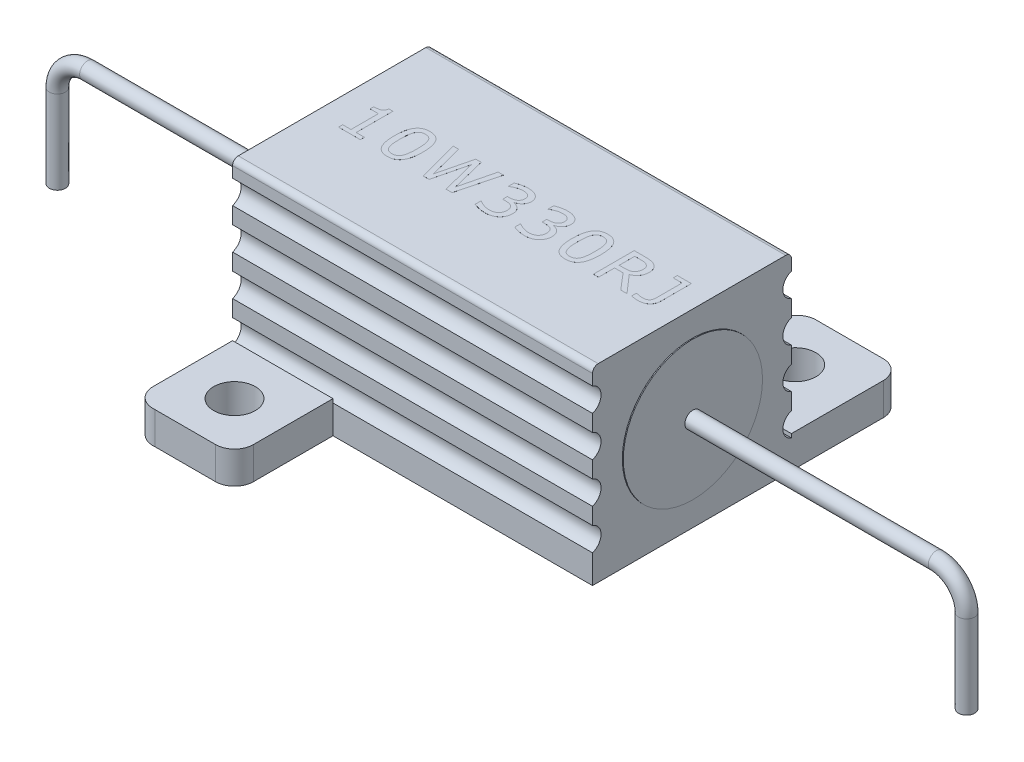
from build123d import *

# Parameters (mm, degrees)
BOSS_EXTRUDE1_DEPTH = 9.5
SKETCH2_R           = 1.1
BOSS_EXTRUDE2_DEPTH = 1.7
SKETCH3_R           = 3.675
BOSS_EXTRUDE3_DEPTH = 9.55
BOSS_EXTRUDE6_DEPTH = 0.001
SWEEP1_PROFILE_R    = 0.425


with BuildPart() as part:
    # Sketch1 → Boss-Extrude1 (new, symmetric)
    with BuildSketch(Plane(origin=(0, 0, 0), x_dir=(0, 0, -1), z_dir=(1, 0, 0))):
        with BuildLine():
            Line((-4.95, 5), (4.95, 5))
            ThreePointArc((4.95, 5), (5.162132034, 4.912132034), (5.25, 4.7))
            Line((5.25, 4.7), (5.25, 4.125))
            ThreePointArc((5.25, 4.125), (4.8, 3.5), (5.25, 2.875))
            Line((5.25, 2.875), (5.25, 2))
            ThreePointArc((5.25, 2), (4.8, 1.375), (5.25, 0.75))
            Line((5.25, 0.75), (5.25, -0.125))
            ThreePointArc((5.25, -0.125), (4.8, -0.75), (5.25, -1.375))
            Line((5.25, -1.375), (5.25, -2.25))
            ThreePointArc((5.25, -2.25), (4.8, -2.875), (5.25, -3.5))
            Line((5.25, -3.5), (5.25, -5))
            Line((5.25, -5), (-5.25, -5))
            Line((-5.25, -5), (-5.25, -3.5))
            ThreePointArc((-5.25, -3.5), (-4.8, -2.875), (-5.25, -2.25))
            Line((-5.25, -2.25), (-5.25, -1.375))
            ThreePointArc((-5.25, -1.375), (-4.8, -0.75), (-5.25, -0.125))
            Line((-5.25, -0.125), (-5.25, 0.75))
            ThreePointArc((-5.25, 0.75), (-4.8, 1.375), (-5.25, 2))
            Line((-5.25, 2), (-5.25, 2.875))
            ThreePointArc((-5.25, 2.875), (-4.8, 3.5), (-5.25, 4.125))
            Line((-5.25, 4.125), (-5.25, 4.7))
            ThreePointArc((-5.25, 4.7), (-5.162132034, 4.912132034), (-4.95, 5))
        make_face()
    extrude(amount=BOSS_EXTRUDE1_DEPTH, both=True)

    # Sketch2 → Boss-Extrude2 (add)
    # profile 1 of 2: a face of its own
    with BuildSketch(Plane.XZ.offset(5)):
        with BuildLine():
            Line((-4.2, 9.45), (-4.2, 5.25))
            Line((-4.2, 5.25), (-9.5, 5.25))
            Line((-9.5, 5.25), (-9.5, 9.455012563))
            ThreePointArc((-9.5, 9.455012563), (-9.170820393, 10.196632412), (-8.4, 10.45))
            Line((-8.4, 10.45), (-5.2, 10.45))
            ThreePointArc((-5.2, 10.45), (-4.492893219, 10.157106781), (-4.2, 9.45))
        make_face()
        with Locations(Location((-6.8, 7.85, 0), (0, 0, 90))):
            Circle(SKETCH2_R, mode=Mode.SUBTRACT)
    # profile 2 of 2: a face of its own
    with BuildSketch(Plane.XZ.offset(5)):
        with BuildLine():
            Line((4, -9.8), (4, -5.25))
            Line((4, -5.25), (9.5, -5.25))
            Line((9.5, -5.25), (9.5, -10.1))
            ThreePointArc((9.5, -10.1), (9.207106781, -10.807106781), (8.5, -11.1))
            Line((8.5, -11.1), (5, -11.1))
            ThreePointArc((5, -11.1), (4.160975821, -10.71078783), (4, -9.8))
        make_face()
        with Locations(Location((6.45, -8.5, 0), (0, 0, 90))):
            Circle(SKETCH2_R, mode=Mode.SUBTRACT)
    extrude(amount=-BOSS_EXTRUDE2_DEPTH)

    # Sketch3 → Boss-Extrude3 (add, symmetric)
    with BuildSketch(Plane(origin=(0, 0, 0), x_dir=(0, 0, -1), z_dir=(1, 0, 0))):
        with Locations(Location((0, 0, 0), (0, 0, 180))):
            Circle(SKETCH3_R)
    extrude(amount=BOSS_EXTRUDE3_DEPTH, both=True)

    # Sketch7 → Boss-Extrude6 (add)
    # profile 1 of 8: a face of its own
    with BuildSketch(Plane(origin=(0, 5, 0), x_dir=(1, 0, 0), z_dir=(0, 1, 0))):
        with BuildLine():
            add(Edge.make_bspline(
                [(8.301500939, -0.428209134), (8.301062759, -0.451139319), (8.300207962, -0.495871214), (8.29201733, -0.560917209), (8.278328298, -0.621921589), (8.259611151, -0.678890096), (8.235685509, -0.732088674), (8.205617016, -0.780816478), (8.170282201, -0.825541687), (8.130173555, -0.866207529), (8.085145884, -0.902021533), (8.036294909, -0.933177949), (7.983967978, -0.959998554), (7.927662195, -0.980985193), (7.868126832, -0.99839108), (7.804646886, -1.010168803), (7.737531753, -1.016882767), (7.691588805, -1.01795472), (7.66809833, -1.018502806)],
                knots=[0, 0, 0, 0, 1.120755748, 2.186355242, 3.198933757, 4.173448826, 5.113591064, 6.0441882, 6.96548279, 7.895169476, 8.830564272, 9.772249413, 10.724232925, 11.699641407, 12.705819706, 13.753628003, 14.85143754, 16, 16, 16, 16], degree=3))
            add(Edge.make_bspline(
                [(7.66809833, -1.018502806), (7.655576493, -1.018281429), (7.628669118, -1.017805726), (7.585391188, -1.015631182), (7.536466535, -1.011576798), (7.483500798, -1.006784825), (7.430017002, -1.000454105), (7.379492216, -0.993714401), (7.333455228, -0.98665922), (7.304569248, -0.980766212), (7.29078842, -0.977954795)],
                knots=[0, 0, 0, 0, 0.791051374, 1.699839779, 2.736493337, 3.89186054, 5.058981669, 6.138045988, 7.111705107, 8, 8, 8, 8], degree=3))
            Line((7.29078842, -0.977954795), (7.29078842, -0.718020706))
            Line((7.29078842, -0.718020706), (7.307007624, -0.718020706))
            add(Edge.make_bspline(
                [(7.307007624, -0.718020706), (7.317518242, -0.721073113), (7.339727339, -0.727522896), (7.374934936, -0.736281462), (7.413680531, -0.745198697), (7.469865845, -0.758120324), (7.544005961, -0.769903904), (7.604451824, -0.771734522), (7.634806279, -0.772653815)],
                knots=[0, 0, 0, 0, 0.590882725, 1.248544343, 1.958456919, 2.737484183, 4.36164324, 6, 6, 6, 6], degree=3))
            add(Edge.make_bspline(
                [(7.634806279, -0.772653815), (7.656166994, -0.772461792), (7.696565415, -0.77209863), (7.753750946, -0.765824302), (7.804166318, -0.756974089), (7.848135312, -0.743827985), (7.885713307, -0.726302863), (7.918530574, -0.706683731), (7.945823511, -0.682713598), (7.959908837, -0.664069505), (7.966873146, -0.654851173)],
                knots=[0, 0, 0, 0, 1.398250317, 2.64443893, 3.76295224, 4.747439987, 5.639718209, 6.472395588, 7.244695641, 8, 8, 8, 8], degree=3))
            add(Edge.make_bspline(
                [(7.966873146, -0.654851173), (7.973123074, -0.644754521), (7.985890653, -0.624128716), (8.00018326, -0.589718454), (8.010856248, -0.552166937), (8.01792722, -0.511357587), (8.022046048, -0.467230454), (8.026382554, -0.420034325), (8.027586578, -0.36945425), (8.028080428, -0.334734153), (8.028335394, -0.31680881)],
                knots=[0, 0, 0, 0, 0.816858895, 1.668708864, 2.555793622, 3.501563013, 4.516682111, 5.608029468, 6.765069871, 8, 8, 8, 8], degree=3))
            Line((8.028335394, -0.31680881), (8.028335394, 0.948289124))
            Line((8.028335394, 0.948289124), (7.563953966, 0.948289124))
            Line((7.563953966, 0.948289124), (7.563953966, 1.166821561))
            Line((7.563953966, 1.166821561), (8.301500939, 1.166821561))
            Line((8.301500939, 1.166821561), (8.301500939, -0.428209134))
        make_face()
    # profile 2 of 8: a face of its own
    with BuildSketch(Plane(origin=(0, 5, 0), x_dir=(1, 0, 0), z_dir=(0, 1, 0))):
        with BuildLine():
            Line((7.061329361, -0.991186252), (6.732677064, -0.991186252))
            Line((6.732677064, -0.991186252), (6.009642009, -0.144373059))
            Line((6.009642009, -0.144373059), (5.558918859, -0.144373059))
            Line((5.558918859, -0.144373059), (5.558918859, -0.991186252))
            Line((5.558918859, -0.991186252), (5.285753313, -0.991186252))
            Line((5.285753313, -0.991186252), (5.285753313, 1.166821561))
            Line((5.285753313, 1.166821561), (5.881168839, 1.166821561))
            add(Edge.make_bspline(
                [(5.881168839, 1.166821561), (5.911904641, 1.166472923), (5.970853538, 1.165804262), (6.055196595, 1.161362849), (6.131528924, 1.153188929), (6.200821451, 1.142460798), (6.264493868, 1.126868517), (6.324352246, 1.106865387), (6.38084595, 1.081349474), (6.416018135, 1.06031351), (6.433475427, 1.049872562)],
                knots=[0, 0, 0, 0, 1.288415781, 2.47108201, 3.538680541, 4.505415573, 5.408010686, 6.28309489, 7.147834801, 8, 8, 8, 8], degree=3))
            add(Edge.make_bspline(
                [(6.433475427, 1.049872562), (6.452026827, 1.037078239), (6.488585095, 1.011865139), (6.537119705, 0.96673622), (6.579672909, 0.917229328), (6.615529177, 0.862228728), (6.645093896, 0.801194489), (6.664320145, 0.732114873), (6.677231551, 0.655974161), (6.678326802, 0.602624186), (6.678897597, 0.574820604)],
                knots=[0, 0, 0, 0, 0.963681284, 1.899076006, 2.827943621, 3.752026167, 4.702860247, 5.71857009, 6.811022445, 8, 8, 8, 8], degree=3))
            add(Edge.make_bspline(
                [(6.678897597, 0.574820604), (6.678625354, 0.555598427), (6.678091765, 0.517923456), (6.672258237, 0.462607834), (6.663428322, 0.409685206), (6.651117052, 0.358950296), (6.6348117, 0.310761633), (6.615286137, 0.264774292), (6.591531855, 0.221526872), (6.564676259, 0.18058669), (6.534747071, 0.141998395), (6.501618388, 0.106199002), (6.466249688, 0.072220036), (6.427699426, 0.041172177), (6.386656883, 0.012446678), (6.342851411, -0.013476084), (6.29674251, -0.037756999), (6.264283621, -0.051287438), (6.24780822, -0.058155184)],
                knots=[0, 0, 0, 0, 1.126128489, 2.207182719, 3.255820935, 4.268986334, 5.263032379, 6.234153775, 7.193063852, 8.150486488, 9.10116855, 10.051301984, 11.006725633, 11.972966631, 12.949086479, 13.94005042, 14.954415947, 16, 16, 16, 16], degree=3))
            Line((6.24780822, -0.058155184), (7.061329361, -0.991186252))
        make_face()
        with BuildLine():
            add(Edge.make_bspline(
                [(6.378415496, 0.557747758), (6.377971198, 0.572844297), (6.377099984, 0.602446679), (6.371324006, 0.645451141), (6.360741748, 0.685692535), (6.3469982, 0.723523011), (6.327871321, 0.758604596), (6.303778717, 0.790961831), (6.274058419, 0.820260432), (6.251042386, 0.836627929), (6.239271797, 0.844998402)],
                knots=[0, 0, 0, 0, 1.085368415, 2.128268547, 3.1106313, 4.071895604, 5.014699805, 5.972038339, 6.962883605, 8, 8, 8, 8], degree=3))
            add(Edge.make_bspline(
                [(6.239271797, 0.844998402), (6.228604901, 0.85180502), (6.207086192, 0.865536253), (6.17141029, 0.881662578), (6.133145922, 0.894956933), (6.091691298, 0.904385193), (6.047293245, 0.912407267), (5.999182294, 0.916968655), (5.947387007, 0.920798106), (5.911624057, 0.92091308), (5.893119831, 0.92097257)],
                knots=[0, 0, 0, 0, 0.843459406, 1.701540853, 2.6053125, 3.542575708, 4.535326681, 5.614234208, 6.765573065, 8, 8, 8, 8], degree=3))
            Line((5.893119831, 0.92097257), (5.558918859, 0.92097257))
            Line((5.558918859, 0.92097257), (5.558918859, 0.101475932))
            Line((5.558918859, 0.101475932), (5.846169503, 0.101475932))
            add(Edge.make_bspline(
                [(5.846169503, 0.101475932), (5.867940616, 0.101875983), (5.910102619, 0.102650723), (5.971162163, 0.106530503), (6.027777382, 0.114646486), (6.080634985, 0.124057898), (6.129372962, 0.139365906), (6.174597803, 0.158655492), (6.215627535, 0.184205627), (6.239932801, 0.204747189), (6.252076431, 0.215010362)],
                knots=[0, 0, 0, 0, 1.210655428, 2.344558938, 3.398352313, 4.389640028, 5.325372474, 6.232137918, 7.116723723, 8, 8, 8, 8], degree=3))
            add(Edge.make_bspline(
                [(6.252076431, 0.215010362), (6.262457948, 0.225435283), (6.282891639, 0.245954405), (6.308447076, 0.280726063), (6.330481884, 0.317018657), (6.348305899, 0.35624545), (6.362124373, 0.399316777), (6.371832469, 0.447392266), (6.377073819, 0.500864381), (6.377955501, 0.538245239), (6.378415496, 0.557747758)],
                knots=[0, 0, 0, 0, 0.936271895, 1.842841591, 2.741489519, 3.638077323, 4.58130199, 5.617848582, 6.75717263, 8, 8, 8, 8], degree=3))
        make_face(mode=Mode.SUBTRACT)
    # profile 3 of 8: a face of its own
    with BuildSketch(Plane(origin=(0, 5, 0), x_dir=(1, 0, 0), z_dir=(0, 1, 0))):
        with BuildLine():
            add(Edge.make_bspline(
                [(4.591912826, 0.089098118), (4.591353613, 0.041848931), (4.590272953, -0.049458383), (4.581610809, -0.181638091), (4.567992152, -0.304102208), (4.548113125, -0.416947039), (4.522086392, -0.519875811), (4.491359082, -0.613537941), (4.454273883, -0.697330653), (4.411111584, -0.771557169), (4.361383045, -0.836281508), (4.306227081, -0.89291909), (4.243999476, -0.940318371), (4.175378527, -0.978887087), (4.100625831, -1.009523582), (4.01934013, -1.030460626), (3.932048472, -1.043592204), (3.871772552, -1.045061906), (3.840707575, -1.045819361)],
                knots=[0, 0, 0, 0, 1.462515791, 2.826257887, 4.098588437, 5.27524076, 6.370122553, 7.382635979, 8.323051561, 9.201518962, 10.033957328, 10.843681618, 11.641751814, 12.446417794, 13.274089048, 14.135116487, 15.038877147, 16, 16, 16, 16], degree=3))
            add(Edge.make_bspline(
                [(3.840707575, -1.045819361), (3.809212218, -1.045098232), (3.74805899, -1.043698047), (3.659634021, -1.030066088), (3.5776768, -1.008737016), (3.502453028, -0.977966512), (3.433460505, -0.939199462), (3.371546893, -0.890664903), (3.315852417, -0.833906211), (3.267463826, -0.767632726), (3.225245962, -0.692694118), (3.188330153, -0.608837037), (3.158064046, -0.515475498), (3.133099403, -0.412986518), (3.113023383, -0.301410168), (3.099241818, -0.18037659), (3.091304605, -0.050010601), (3.090116532, 0.040002392), (3.089502324, 0.086537191)],
                knots=[0, 0, 0, 0, 0.975561823, 1.894207913, 2.765987644, 3.594712337, 4.406414096, 5.210884434, 6.024787292, 6.863552976, 7.746360406, 8.68618482, 9.698595331, 10.784175386, 11.95364431, 13.210072149, 14.557666754, 16, 16, 16, 16], degree=3))
            add(Edge.make_bspline(
                [(3.089502324, 0.086537191), (3.090065458, 0.133359552), (3.091155063, 0.223956004), (3.099777381, 0.355000449), (3.113451301, 0.476611919), (3.133437337, 0.588673687), (3.158839964, 0.691437414), (3.189724778, 0.785011098), (3.226741865, 0.86901978), (3.26958212, 0.943767297), (3.318583977, 1.009428031), (3.37406986, 1.066527212), (3.436481632, 1.114483883), (3.504939473, 1.154241965), (3.57996298, 1.184704721), (3.661388042, 1.205601292), (3.748902543, 1.219364942), (3.809494326, 1.220744173), (3.840707575, 1.22145467)],
                knots=[0, 0, 0, 0, 1.450126419, 2.805845482, 4.065763501, 5.238744047, 6.328896909, 7.341983365, 8.2869572, 9.167511018, 10.004780552, 10.818108853, 11.62549425, 12.434993413, 13.263133086, 14.124647823, 15.033931127, 16, 16, 16, 16], degree=3))
            add(Edge.make_bspline(
                [(3.840707575, 1.22145467), (3.872198672, 1.220719142), (3.933343628, 1.219290997), (4.021863604, 1.205850454), (4.103830389, 1.183766123), (4.179386413, 1.15307733), (4.247893205, 1.112871696), (4.310048073, 1.06419704), (4.36557078, 1.006491624), (4.413826829, 0.939473181), (4.456306068, 0.863970861), (4.492829151, 0.779667173), (4.523323976, 0.686246914), (4.548896734, 0.584304748), (4.568214851, 0.473149532), (4.582207954, 0.353177198), (4.590091653, 0.224079336), (4.591292665, 0.135063048), (4.591912826, 0.089098118)],
                knots=[0, 0, 0, 0, 0.976576377, 1.896177831, 2.770013405, 3.605358433, 4.418491692, 5.226516336, 6.047603033, 6.894359061, 7.781924088, 8.73081062, 9.740083278, 10.827858728, 11.989075843, 13.238041405, 14.5738202, 16, 16, 16, 16], degree=3))
        make_face()
        with BuildLine():
            add(Edge.make_bspline(
                [(4.204786029, -0.571621046), (4.212790423, -0.551103816), (4.229194022, -0.509057354), (4.24826829, -0.441937656), (4.262958171, -0.369841197), (4.27394369, -0.292130347), (4.281927947, -0.207948723), (4.287228022, -0.116116364), (4.290682758, -0.016210645), (4.291175043, 0.053099756), (4.291430726, 0.089098118)],
                knots=[0, 0, 0, 0, 0.787920239, 1.614704221, 2.493559176, 3.419679904, 4.422442709, 5.519279532, 6.711566037, 8, 8, 8, 8], degree=3))
            add(Edge.make_bspline(
                [(4.291430726, 0.089098118), (4.291172523, 0.124811988), (4.290673481, 0.193837932), (4.287219407, 0.293599845), (4.281890217, 0.386144012), (4.273857773, 0.471584061), (4.263298559, 0.550551176), (4.247721713, 0.622773387), (4.229217685, 0.689254479), (4.211897155, 0.730051576), (4.203505566, 0.749817282)],
                knots=[0, 0, 0, 0, 1.277209098, 2.468524563, 3.569546968, 4.59175249, 5.537266852, 6.41645201, 7.232789931, 8, 8, 8, 8], degree=3))
            add(Edge.make_bspline(
                [(4.203505566, 0.749817282), (4.194664368, 0.767537488), (4.177466934, 0.8020059), (4.145564361, 0.848757326), (4.107644428, 0.887422179), (4.06599911, 0.920240868), (4.018280356, 0.945380836), (3.964698204, 0.963246088), (3.904729496, 0.973970072), (3.862664133, 0.975044741), (3.840707575, 0.975605679)],
                knots=[0, 0, 0, 0, 1.041868962, 2.026588758, 2.964039316, 3.882297917, 4.806977878, 5.787445238, 6.845128519, 8, 8, 8, 8], degree=3))
            add(Edge.make_bspline(
                [(3.840707575, 0.975605679), (3.819033587, 0.975044649), (3.777389248, 0.973966689), (3.717745127, 0.96312823), (3.663882424, 0.945317559), (3.615536568, 0.920184203), (3.572608741, 0.887757614), (3.535306203, 0.84744272), (3.501405477, 0.800916412), (3.48420456, 0.765493741), (3.475348658, 0.747256355)],
                knots=[0, 0, 0, 0, 1.130982529, 2.173066616, 3.152892545, 4.083472911, 5.006338149, 5.947185184, 6.943106974, 8, 8, 8, 8], degree=3))
            add(Edge.make_bspline(
                [(3.475348658, 0.747256355), (3.467417683, 0.728045244), (3.450731904, 0.687627465), (3.432547298, 0.620820724), (3.417779586, 0.546216536), (3.407024356, 0.464202415), (3.399782112, 0.376146599), (3.394240555, 0.283357597), (3.390776038, 0.186296991), (3.390252013, 0.120258923), (3.389984424, 0.086537191)],
                knots=[0, 0, 0, 0, 0.743461611, 1.564150376, 2.473168407, 3.465097376, 4.523434166, 5.635793492, 6.792739709, 8, 8, 8, 8], degree=3))
            add(Edge.make_bspline(
                [(3.389984424, 0.086537191), (3.390105774, 0.050255661), (3.390338051, -0.019191166), (3.393245481, -0.118821509), (3.398462643, -0.209177721), (3.404798114, -0.291280735), (3.415040476, -0.366733574), (3.429500009, -0.437366153), (3.448282498, -0.504222076), (3.465294976, -0.546288192), (3.473641373, -0.566926013)],
                knots=[0, 0, 0, 0, 1.312806302, 2.512855192, 3.605999759, 4.587601144, 5.491851682, 6.359134938, 7.194984378, 8, 8, 8, 8], degree=3))
            add(Edge.make_bspline(
                [(3.473641373, -0.566926013), (3.481983691, -0.58496742), (3.498169428, -0.619971292), (3.529868167, -0.66709745), (3.5663186, -0.707718596), (3.608293817, -0.741739158), (3.656700257, -0.768158492), (3.711785998, -0.786953231), (3.773975439, -0.797923201), (3.817755499, -0.799266259), (3.840707575, -0.799970369)],
                knots=[0, 0, 0, 0, 1.023553745, 1.985895355, 2.915557442, 3.828632731, 4.757744765, 5.743701395, 6.817115868, 8, 8, 8, 8], degree=3))
            add(Edge.make_bspline(
                [(3.840707575, -0.799970369), (3.862378446, -0.799395458), (3.904156905, -0.798287107), (3.963978402, -0.787577787), (4.018038662, -0.769562447), (4.066669606, -0.744690867), (4.109618091, -0.712079271), (4.146985289, -0.672038938), (4.180027505, -0.625282326), (4.196374099, -0.589852946), (4.204786029, -0.571621046)],
                knots=[0, 0, 0, 0, 1.131665358, 2.181695236, 3.162112733, 4.099850787, 5.023273204, 5.964688273, 6.952632, 8, 8, 8, 8], degree=3))
        make_face(mode=Mode.SUBTRACT)
    # profile 4 of 8: a face of its own
    with BuildSketch(Plane(origin=(0, 5, 0), x_dir=(1, 0, 0), z_dir=(0, 1, 0))):
        with BuildLine():
            add(Edge.make_bspline(
                [(2.318407206, 0.038306399), (2.329741877, 0.027434295), (2.352615246, 0.005494383), (2.382892552, -0.031934161), (2.409892637, -0.07333568), (2.434112542, -0.118776204), (2.454238928, -0.169975043), (2.467949121, -0.227843913), (2.475894509, -0.292543562), (2.47702037, -0.337841448), (2.477611501, -0.361625033)],
                knots=[0, 0, 0, 0, 0.847484043, 1.710223126, 2.592412854, 3.513457184, 4.486482436, 5.554204071, 6.715838676, 8, 8, 8, 8], degree=3))
            add(Edge.make_bspline(
                [(2.477611501, -0.361625033), (2.476937271, -0.385842565), (2.475614812, -0.433343646), (2.465716048, -0.503231019), (2.448546894, -0.569828116), (2.425105262, -0.633219159), (2.395381115, -0.692643501), (2.36075859, -0.748659023), (2.320114662, -0.800530108), (2.289134304, -0.831706064), (2.273590984, -0.847347519)],
                knots=[0, 0, 0, 0, 1.072189339, 2.103028086, 3.117625413, 4.112331199, 5.08999265, 6.054966346, 7.024146796, 8, 8, 8, 8], degree=3))
            add(Edge.make_bspline(
                [(2.273590984, -0.847347519), (2.255007504, -0.863568109), (2.217858512, -0.895993608), (2.155782418, -0.937102328), (2.08888788, -0.97110119), (2.017773094, -0.999149828), (1.94220383, -1.019586564), (1.863234345, -1.035151263), (1.780536157, -1.044138454), (1.724293334, -1.045252498), (1.695675126, -1.045819361)],
                knots=[0, 0, 0, 0, 0.94513944, 1.889365109, 2.845868606, 3.818496383, 4.815247057, 5.843513068, 6.902708155, 8, 8, 8, 8], degree=3))
            add(Edge.make_bspline(
                [(1.695675126, -1.045819361), (1.665777311, -1.045376896), (1.606296979, -1.044496634), (1.517391805, -1.035848328), (1.429287983, -1.022876996), (1.34319404, -1.004498486), (1.261569014, -0.982961931), (1.186434494, -0.959915109), (1.118750997, -0.936407467), (1.076982145, -0.918562746), (1.057150663, -0.91009023)],
                knots=[0, 0, 0, 0, 1.091633847, 2.17175542, 3.259350248, 4.342654255, 5.384955613, 6.341552815, 7.212583926, 8, 8, 8, 8], degree=3))
            Line((1.057150663, -0.91009023), (1.057150663, -0.608754487))
            Line((1.057150663, -0.608754487), (1.078918542, -0.608754487))
            add(Edge.make_bspline(
                [(1.078918542, -0.608754487), (1.100088183, -0.622133339), (1.143267128, -0.649421694), (1.212675866, -0.685678955), (1.287680816, -0.718009289), (1.366775349, -0.746516831), (1.447828738, -0.770727221), (1.528884681, -0.786917953), (1.608441044, -0.798006767), (1.661066301, -0.799319831), (1.687138703, -0.799970369)],
                knots=[0, 0, 0, 0, 0.930231768, 1.897359876, 2.905960645, 3.962824014, 5.020110383, 6.045473768, 7.03165901, 8, 8, 8, 8], degree=3))
            add(Edge.make_bspline(
                [(1.687138703, -0.799970369), (1.702524549, -0.799696379), (1.733979242, -0.799136234), (1.78157488, -0.792637156), (1.830638332, -0.783271261), (1.880073441, -0.770325679), (1.928205586, -0.753863565), (1.972288722, -0.732742977), (2.0121121, -0.708795986), (2.034953095, -0.689177175), (2.046095303, -0.679606801)],
                knots=[0, 0, 0, 0, 0.955105117, 1.9526087, 2.978673282, 4.056885304, 5.124578998, 6.132597257, 7.089050672, 8, 8, 8, 8], degree=3))
            add(Edge.make_bspline(
                [(2.046095303, -0.679606801), (2.056750154, -0.668888517), (2.077648257, -0.647866001), (2.103936315, -0.612773119), (2.126923709, -0.576886681), (2.145739319, -0.538637893), (2.160002434, -0.496623092), (2.170042133, -0.450097137), (2.175929865, -0.39848164), (2.17671784, -0.362494632), (2.177129401, -0.343698544)],
                knots=[0, 0, 0, 0, 0.974089691, 1.910549984, 2.822386268, 3.721564009, 4.653513387, 5.678162238, 6.787299389, 8, 8, 8, 8], degree=3))
            add(Edge.make_bspline(
                [(2.177129401, -0.343698544), (2.176837024, -0.325173071), (2.176274492, -0.289530157), (2.168779715, -0.238788019), (2.157566489, -0.192802842), (2.141053424, -0.151945396), (2.121029727, -0.115242734), (2.096900645, -0.083056232), (2.069413945, -0.054766153), (2.048461572, -0.039383412), (2.037985701, -0.031692272)],
                knots=[0, 0, 0, 0, 1.246176778, 2.397637793, 3.445421562, 4.425515979, 5.35590216, 6.252488577, 7.126270542, 8, 8, 8, 8], degree=3))
            add(Edge.make_bspline(
                [(2.037985701, -0.031692272), (2.026625641, -0.024425635), (2.003665938, -0.009739109), (1.965364578, 0.007238614), (1.923883914, 0.020882292), (1.863013011, 0.034365989), (1.781077875, 0.044359602), (1.714058006, 0.045997291), (1.679455922, 0.046842823)],
                knots=[0, 0, 0, 0, 0.651204319, 1.316142418, 2.018760635, 2.759665618, 4.327028642, 6, 6, 6, 6], degree=3))
            Line((1.679455922, 0.046842823), (1.548848645, 0.046842823))
            Line((1.548848645, 0.046842823), (1.548848645, 0.292691814))
            Line((1.548848645, 0.292691814), (1.648297977, 0.292691814))
            add(Edge.make_bspline(
                [(1.648297977, 0.292691814), (1.66595428, 0.292837097), (1.70033873, 0.293120025), (1.750328651, 0.298212538), (1.797777688, 0.305110136), (1.842351107, 0.315946423), (1.884410525, 0.329008417), (1.923681373, 0.345234282), (1.959875418, 0.365105176), (1.993793279, 0.387046385), (2.024115449, 0.412163424), (2.050561429, 0.440226785), (2.072762961, 0.471171042), (2.09142969, 0.504706991), (2.105474388, 0.541228751), (2.115143592, 0.580391041), (2.121288164, 0.622147447), (2.122085541, 0.650914719), (2.122496292, 0.665733513)],
                knots=[0, 0, 0, 0, 1.240419804, 2.415633327, 3.528743283, 4.608144501, 5.636053556, 6.622252983, 7.58878585, 8.534609379, 9.457798559, 10.349242878, 11.237427791, 12.12814259, 13.039995841, 13.978654942, 14.958750962, 16, 16, 16, 16], degree=3))
            add(Edge.make_bspline(
                [(2.122496292, 0.665733513), (2.122069319, 0.678842931), (2.121243136, 0.70420941), (2.115332252, 0.741167284), (2.104520956, 0.775378833), (2.089925419, 0.807152569), (2.07187676, 0.836408978), (2.050480596, 0.863045796), (2.025502928, 0.886716611), (2.006849387, 0.90012316), (1.99743769, 0.906887471)],
                knots=[0, 0, 0, 0, 1.109336041, 2.146544552, 3.155699887, 4.136221373, 5.098536494, 6.057531715, 7.019922155, 8, 8, 8, 8], degree=3))
            add(Edge.make_bspline(
                [(1.99743769, 0.906887471), (1.987160948, 0.913064867), (1.96667433, 0.925379465), (1.934007817, 0.940233071), (1.900299567, 0.952219099), (1.852637139, 0.964403863), (1.787779443, 0.97351487), (1.734405411, 0.974885246), (1.706345655, 0.975605679)],
                knots=[0, 0, 0, 0, 0.711216309, 1.417805135, 2.125604048, 2.832243336, 4.334649322, 6, 6, 6, 6], degree=3))
            add(Edge.make_bspline(
                [(1.706345655, 0.975605679), (1.683269074, 0.97502669), (1.636079402, 0.973842705), (1.564393765, 0.964024989), (1.49062437, 0.947871921), (1.415311646, 0.926536541), (1.340240749, 0.898557706), (1.266225965, 0.866444488), (1.194663135, 0.828324551), (1.149151502, 0.799077554), (1.126295691, 0.784389797)],
                knots=[0, 0, 0, 0, 0.894418222, 1.829010174, 2.799457441, 3.820802859, 4.860878205, 5.903159842, 6.946972907, 8, 8, 8, 8], degree=3))
            Line((1.126295691, 0.784389797), (1.111783772, 0.784389797))
            Line((1.111783772, 0.784389797), (1.111783772, 1.085725539))
            add(Edge.make_bspline(
                [(1.111783772, 1.085725539), (1.130179631, 1.094212209), (1.169266543, 1.112244404), (1.233638672, 1.135887408), (1.306581323, 1.158120227), (1.386207009, 1.179576025), (1.469516631, 1.198425731), (1.553390751, 1.211306909), (1.635876039, 1.220082451), (1.690388892, 1.220999533), (1.717443006, 1.22145467)],
                knots=[0, 0, 0, 0, 0.777624147, 1.652270079, 2.630230247, 3.704883216, 4.818215269, 5.907609184, 6.961570091, 8, 8, 8, 8], degree=3))
            add(Edge.make_bspline(
                [(1.717443006, 1.22145467), (1.742920014, 1.221176123), (1.792373902, 1.22063543), (1.864221425, 1.215065661), (1.93133547, 1.20567354), (1.994334565, 1.193027788), (2.053465045, 1.175950294), (2.109442777, 1.154422096), (2.162489496, 1.12869606), (2.195385284, 1.10767591), (2.211701915, 1.097249711)],
                knots=[0, 0, 0, 0, 1.181529625, 2.293488736, 3.339666156, 4.323260697, 5.271417361, 6.190562388, 7.102501307, 8, 8, 8, 8], degree=3))
            add(Edge.make_bspline(
                [(2.211701915, 1.097249711), (2.228409351, 1.085295121), (2.261094397, 1.06190815), (2.303557239, 1.020135481), (2.340278428, 0.975244826), (2.370248872, 0.926210439), (2.394141735, 0.87337885), (2.411203981, 0.816439676), (2.421026834, 0.755136982), (2.422315741, 0.71300408), (2.422978392, 0.691342783)],
                knots=[0, 0, 0, 0, 1.030246025, 2.015488056, 2.980657051, 3.93641939, 4.892528807, 5.884791777, 6.912532717, 8, 8, 8, 8], degree=3))
            add(Edge.make_bspline(
                [(2.422978392, 0.691342783), (2.422501414, 0.676248291), (2.421562259, 0.646527681), (2.416114119, 0.60258299), (2.406079219, 0.560391802), (2.392863646, 0.519273126), (2.375444895, 0.479777148), (2.353774872, 0.441891408), (2.328475629, 0.40548683), (2.299680813, 0.37088041), (2.26821743, 0.338550217), (2.234898687, 0.309298653), (2.200729998, 0.282446054), (2.164740251, 0.259249653), (2.127007601, 0.239951347), (2.088508679, 0.22244103), (2.048332455, 0.208725709), (2.020691673, 0.202393869), (2.006827756, 0.199217979)],
                knots=[0, 0, 0, 0, 1.040593361, 2.04889782, 3.04554796, 4.02546284, 5.02211298, 6.014605761, 7.029232238, 8.073837562, 9.114015009, 10.135206882, 11.127699663, 12.1069274, 13.080640536, 14.04642105, 15.020134186, 16, 16, 16, 16], degree=3))
            Line((2.006827756, 0.199217979), (2.006827756, 0.178730563))
            add(Edge.make_bspline(
                [(2.006827756, 0.178730563), (2.018818421, 0.176485879), (2.044012575, 0.171769466), (2.082543871, 0.160803738), (2.123754457, 0.147128187), (2.166362659, 0.130340707), (2.20887412, 0.111196557), (2.248920893, 0.089557838), (2.285740231, 0.065721423), (2.307624758, 0.047355327), (2.318407206, 0.038306399)],
                knots=[0, 0, 0, 0, 0.847072829, 1.779824847, 2.779997163, 3.862895895, 4.959821874, 6.016836294, 7.022900478, 8, 8, 8, 8], degree=3))
        make_face()
    # profile 5 of 8: a face of its own
    with BuildSketch(Plane(origin=(0, 5, 0), x_dir=(1, 0, 0), z_dir=(0, 1, 0))):
        with BuildLine():
            add(Edge.make_bspline(
                [(0.231422436, 0.038306399), (0.242757106, 0.027434295), (0.265630475, 0.005494383), (0.295907781, -0.031934161), (0.322907867, -0.07333568), (0.347127771, -0.118776204), (0.367254158, -0.169975043), (0.38096435, -0.227843913), (0.388909738, -0.292543562), (0.390035599, -0.337841448), (0.390626731, -0.361625033)],
                knots=[0, 0, 0, 0, 0.847484043, 1.710223126, 2.592412854, 3.513457184, 4.486482436, 5.554204071, 6.715838676, 8, 8, 8, 8], degree=3))
            add(Edge.make_bspline(
                [(0.390626731, -0.361625033), (0.3899525, -0.385842565), (0.388630041, -0.433343646), (0.378731277, -0.503231019), (0.361562124, -0.569828116), (0.338120491, -0.633219159), (0.308396345, -0.692643501), (0.273773819, -0.748659023), (0.233129891, -0.800530108), (0.202149534, -0.831706064), (0.186606214, -0.847347519)],
                knots=[0, 0, 0, 0, 1.072189339, 2.103028086, 3.117625413, 4.112331199, 5.08999265, 6.054966346, 7.024146796, 8, 8, 8, 8], degree=3))
            add(Edge.make_bspline(
                [(0.186606214, -0.847347519), (0.168022734, -0.863568109), (0.130873741, -0.895993608), (0.068797647, -0.937102328), (0.001903109, -0.97110119), (-0.069211676, -0.999149828), (-0.144780941, -1.019586564), (-0.223750426, -1.035151263), (-0.306448614, -1.044138454), (-0.362691437, -1.045252498), (-0.391309644, -1.045819361)],
                knots=[0, 0, 0, 0, 0.94513944, 1.889365109, 2.845868606, 3.818496383, 4.815247057, 5.843513068, 6.902708155, 8, 8, 8, 8], degree=3))
            add(Edge.make_bspline(
                [(-0.391309644, -1.045819361), (-0.42120746, -1.045376896), (-0.480687791, -1.044496634), (-0.569592966, -1.035848328), (-0.657696788, -1.022876996), (-0.743790731, -1.004498486), (-0.825415756, -0.982961931), (-0.900550276, -0.959915109), (-0.968233773, -0.936407467), (-1.010002626, -0.918562746), (-1.029834108, -0.91009023)],
                knots=[0, 0, 0, 0, 1.091633847, 2.17175542, 3.259350248, 4.342654255, 5.384955613, 6.341552815, 7.212583926, 8, 8, 8, 8], degree=3))
            Line((-1.029834108, -0.91009023), (-1.029834108, -0.608754487))
            Line((-1.029834108, -0.608754487), (-1.008066229, -0.608754487))
            add(Edge.make_bspline(
                [(-1.008066229, -0.608754487), (-0.986896588, -0.622133339), (-0.943717642, -0.649421694), (-0.874308904, -0.685678955), (-0.799303955, -0.718009289), (-0.720209422, -0.746516831), (-0.639156032, -0.770727221), (-0.55810009, -0.786917953), (-0.478543726, -0.798006767), (-0.425918469, -0.799319831), (-0.399846068, -0.799970369)],
                knots=[0, 0, 0, 0, 0.930231768, 1.897359876, 2.905960645, 3.962824014, 5.020110383, 6.045473768, 7.03165901, 8, 8, 8, 8], degree=3))
            add(Edge.make_bspline(
                [(-0.399846068, -0.799970369), (-0.384460221, -0.799696379), (-0.353005529, -0.799136234), (-0.305409891, -0.792637156), (-0.256346439, -0.783271261), (-0.20691133, -0.770325679), (-0.158779185, -0.753863565), (-0.114696048, -0.732742977), (-0.074872671, -0.708795986), (-0.052031675, -0.689177175), (-0.040889468, -0.679606801)],
                knots=[0, 0, 0, 0, 0.955105117, 1.9526087, 2.978673282, 4.056885304, 5.124578998, 6.132597257, 7.089050672, 8, 8, 8, 8], degree=3))
            add(Edge.make_bspline(
                [(-0.040889468, -0.679606801), (-0.030234616, -0.668888517), (-0.009336514, -0.647866001), (0.016951544, -0.612773119), (0.039938938, -0.576886681), (0.058754548, -0.538637893), (0.073017664, -0.496623092), (0.083057362, -0.450097137), (0.088945095, -0.39848164), (0.089733069, -0.362494632), (0.09014463, -0.343698544)],
                knots=[0, 0, 0, 0, 0.974089691, 1.910549984, 2.822386268, 3.721564009, 4.653513387, 5.678162238, 6.787299389, 8, 8, 8, 8], degree=3))
            add(Edge.make_bspline(
                [(0.09014463, -0.343698544), (0.089852253, -0.325173071), (0.089289722, -0.289530157), (0.081794945, -0.238788019), (0.070581719, -0.192802842), (0.054068653, -0.151945396), (0.034044956, -0.115242734), (0.009915874, -0.083056232), (-0.017570826, -0.054766153), (-0.038523198, -0.039383412), (-0.04899907, -0.031692272)],
                knots=[0, 0, 0, 0, 1.246176778, 2.397637793, 3.445421562, 4.425515979, 5.35590216, 6.252488577, 7.126270542, 8, 8, 8, 8], degree=3))
            add(Edge.make_bspline(
                [(-0.04899907, -0.031692272), (-0.06035913, -0.024425635), (-0.083318832, -0.009739109), (-0.121620192, 0.007238614), (-0.163100856, 0.020882292), (-0.223971759, 0.034365989), (-0.305906896, 0.044359602), (-0.372926765, 0.045997291), (-0.407528849, 0.046842823)],
                knots=[0, 0, 0, 0, 0.651204319, 1.316142418, 2.018760635, 2.759665618, 4.327028642, 6, 6, 6, 6], degree=3))
            Line((-0.407528849, 0.046842823), (-0.538136125, 0.046842823))
            Line((-0.538136125, 0.046842823), (-0.538136125, 0.292691814))
            Line((-0.538136125, 0.292691814), (-0.438686794, 0.292691814))
            add(Edge.make_bspline(
                [(-0.438686794, 0.292691814), (-0.421030491, 0.292837097), (-0.38664604, 0.293120025), (-0.336656119, 0.298212538), (-0.289207083, 0.305110136), (-0.244633664, 0.315946423), (-0.202574245, 0.329008417), (-0.163303397, 0.345234282), (-0.127109353, 0.365105176), (-0.093191492, 0.387046385), (-0.062869321, 0.412163424), (-0.036423341, 0.440226785), (-0.01422181, 0.471171042), (0.004444919, 0.504706991), (0.018489618, 0.541228751), (0.028158822, 0.580391041), (0.034303393, 0.622147447), (0.035100771, 0.650914719), (0.035511521, 0.665733513)],
                knots=[0, 0, 0, 0, 1.240419804, 2.415633327, 3.528743283, 4.608144501, 5.636053556, 6.622252983, 7.58878585, 8.534609379, 9.457798559, 10.349242878, 11.237427791, 12.12814259, 13.039995841, 13.978654942, 14.958750962, 16, 16, 16, 16], degree=3))
            add(Edge.make_bspline(
                [(0.035511521, 0.665733513), (0.035084549, 0.678842931), (0.034258365, 0.70420941), (0.028347481, 0.741167284), (0.017536185, 0.775378833), (0.002940649, 0.807152569), (-0.015108011, 0.836408978), (-0.036504175, 0.863045796), (-0.061481843, 0.886716611), (-0.080135384, 0.90012316), (-0.089547081, 0.906887471)],
                knots=[0, 0, 0, 0, 1.109336041, 2.146544552, 3.155699887, 4.136221373, 5.098536494, 6.057531715, 7.019922155, 8, 8, 8, 8], degree=3))
            add(Edge.make_bspline(
                [(-0.089547081, 0.906887471), (-0.099823822, 0.913064867), (-0.120310441, 0.925379465), (-0.152976953, 0.940233071), (-0.186685203, 0.952219099), (-0.234347632, 0.964403863), (-0.299205328, 0.97351487), (-0.352579359, 0.974885246), (-0.380639115, 0.975605679)],
                knots=[0, 0, 0, 0, 0.711216309, 1.417805135, 2.125604048, 2.832243336, 4.334649322, 6, 6, 6, 6], degree=3))
            add(Edge.make_bspline(
                [(-0.380639115, 0.975605679), (-0.403715697, 0.97502669), (-0.450905369, 0.973842705), (-0.522591006, 0.964024989), (-0.596360401, 0.947871921), (-0.671673124, 0.926536541), (-0.746744022, 0.898557706), (-0.820758805, 0.866444488), (-0.892321636, 0.828324551), (-0.937833268, 0.799077554), (-0.960689079, 0.784389797)],
                knots=[0, 0, 0, 0, 0.894418222, 1.829010174, 2.799457441, 3.820802859, 4.860878205, 5.903159842, 6.946972907, 8, 8, 8, 8], degree=3))
            Line((-0.960689079, 0.784389797), (-0.975200999, 0.784389797))
            Line((-0.975200999, 0.784389797), (-0.975200999, 1.085725539))
            add(Edge.make_bspline(
                [(-0.975200999, 1.085725539), (-0.95680514, 1.094212209), (-0.917718227, 1.112244404), (-0.853346098, 1.135887408), (-0.780403447, 1.158120227), (-0.700777761, 1.179576025), (-0.617468139, 1.198425731), (-0.533594019, 1.211306909), (-0.451108732, 1.220082451), (-0.396595878, 1.220999533), (-0.369541765, 1.22145467)],
                knots=[0, 0, 0, 0, 0.777624147, 1.652270079, 2.630230247, 3.704883216, 4.818215269, 5.907609184, 6.961570091, 8, 8, 8, 8], degree=3))
            add(Edge.make_bspline(
                [(-0.369541765, 1.22145467), (-0.344064756, 1.221176123), (-0.294610869, 1.22063543), (-0.222763345, 1.215065661), (-0.155649301, 1.20567354), (-0.092650205, 1.193027788), (-0.033519726, 1.175950294), (0.022458006, 1.154422096), (0.075504725, 1.12869606), (0.108400513, 1.10767591), (0.124717145, 1.097249711)],
                knots=[0, 0, 0, 0, 1.181529625, 2.293488736, 3.339666156, 4.323260697, 5.271417361, 6.190562388, 7.102501307, 8, 8, 8, 8], degree=3))
            add(Edge.make_bspline(
                [(0.124717145, 1.097249711), (0.141424581, 1.085295121), (0.174109626, 1.06190815), (0.216572469, 1.020135481), (0.253293658, 0.975244826), (0.283264102, 0.926210439), (0.307156964, 0.87337885), (0.324219211, 0.816439676), (0.334042064, 0.755136982), (0.335330971, 0.71300408), (0.335993621, 0.691342783)],
                knots=[0, 0, 0, 0, 1.030246025, 2.015488056, 2.980657051, 3.93641939, 4.892528807, 5.884791777, 6.912532717, 8, 8, 8, 8], degree=3))
            add(Edge.make_bspline(
                [(0.335993621, 0.691342783), (0.335516644, 0.676248291), (0.334577488, 0.646527681), (0.329129348, 0.60258299), (0.319094448, 0.560391802), (0.305878876, 0.519273126), (0.288460124, 0.479777148), (0.266790102, 0.441891408), (0.241490858, 0.40548683), (0.212696042, 0.37088041), (0.18123266, 0.338550217), (0.147913917, 0.309298653), (0.113745227, 0.282446054), (0.077755481, 0.259249653), (0.040022831, 0.239951347), (0.001523909, 0.22244103), (-0.038652316, 0.208725709), (-0.066293098, 0.202393869), (-0.080157015, 0.199217979)],
                knots=[0, 0, 0, 0, 1.040593361, 2.04889782, 3.04554796, 4.02546284, 5.02211298, 6.014605761, 7.029232238, 8.073837562, 9.114015009, 10.135206882, 11.127699663, 12.1069274, 13.080640536, 14.04642105, 15.020134186, 16, 16, 16, 16], degree=3))
            Line((-0.080157015, 0.199217979), (-0.080157015, 0.178730563))
            add(Edge.make_bspline(
                [(-0.080157015, 0.178730563), (-0.06816635, 0.176485879), (-0.042972196, 0.171769466), (-0.0044409, 0.160803738), (0.036769686, 0.147128187), (0.079377888, 0.130340707), (0.12188935, 0.111196557), (0.161936123, 0.089557838), (0.198755461, 0.065721423), (0.220639987, 0.047355327), (0.231422436, 0.038306399)],
                knots=[0, 0, 0, 0, 0.847072829, 1.779824847, 2.779997163, 3.862895895, 4.959821874, 6.016836294, 7.022900478, 8, 8, 8, 8], degree=3))
        make_face()
    # profile 6 of 8: a face of its own
    with BuildSketch(Plane(origin=(0, 5, 0), x_dir=(1, 0, 0), z_dir=(0, 1, 0))):
        Polygon((-1.614408376, 1.166821561), (-2.171409997, -0.991186252), (-2.492379514, -0.991186252), (-2.942675843, 0.80018218), (-3.383155286, -0.991186252), (-3.696868842, -0.991186252), (-4.264114171, 1.166821561), (-3.981985381, 1.166821561), (-3.521445343, -0.627534619), (-3.077978153, 1.166821561), (-2.789020223, 1.166821561), (-2.341284821, -0.644607465), (-1.896537167, 1.166821561), align=None)
    # profile 7 of 8: a face of its own
    with BuildSketch(Plane(origin=(0, 5, 0), x_dir=(1, 0, 0), z_dir=(0, 1, 0))):
        with BuildLine():
            add(Edge.make_bspline(
                [(-4.79405533, 0.089098118), (-4.794614544, 0.041848931), (-4.795695204, -0.049458383), (-4.804357348, -0.181638091), (-4.817976004, -0.304102208), (-4.837855031, -0.416947039), (-4.863881765, -0.519875811), (-4.894609075, -0.613537941), (-4.931694274, -0.697330653), (-4.974856573, -0.771557169), (-5.024585112, -0.836281508), (-5.079741076, -0.89291909), (-5.141968681, -0.940318371), (-5.21058963, -0.978887087), (-5.285342325, -1.009523582), (-5.366628027, -1.030460626), (-5.453919685, -1.043592204), (-5.514195604, -1.045061906), (-5.545260581, -1.045819361)],
                knots=[0, 0, 0, 0, 1.462515791, 2.826257887, 4.098588437, 5.27524076, 6.370122553, 7.382635979, 8.323051561, 9.201518962, 10.033957328, 10.843681618, 11.641751814, 12.446417794, 13.274089048, 14.135116487, 15.038877147, 16, 16, 16, 16], degree=3))
            add(Edge.make_bspline(
                [(-5.545260581, -1.045819361), (-5.576755939, -1.045098232), (-5.637909167, -1.043698047), (-5.726334136, -1.030066088), (-5.808291357, -1.008737016), (-5.883515129, -0.977966512), (-5.952507652, -0.939199462), (-6.014421263, -0.890664903), (-6.07011574, -0.833906211), (-6.11850433, -0.767632726), (-6.160722195, -0.692694118), (-6.197638003, -0.608837037), (-6.227904111, -0.515475498), (-6.252868753, -0.412986518), (-6.272944774, -0.301410168), (-6.286726339, -0.18037659), (-6.294663552, -0.050010601), (-6.295851624, 0.040002392), (-6.296465833, 0.086537191)],
                knots=[0, 0, 0, 0, 0.975561823, 1.894207913, 2.765987644, 3.594712337, 4.406414096, 5.210884434, 6.024787292, 6.863552976, 7.746360406, 8.68618482, 9.698595331, 10.784175386, 11.95364431, 13.210072149, 14.557666754, 16, 16, 16, 16], degree=3))
            add(Edge.make_bspline(
                [(-6.296465833, 0.086537191), (-6.295902699, 0.133359552), (-6.294813093, 0.223956004), (-6.286190776, 0.355000449), (-6.272516855, 0.476611919), (-6.25253082, 0.588673687), (-6.227128192, 0.691437414), (-6.196243378, 0.785011098), (-6.159226291, 0.86901978), (-6.116386036, 0.943767297), (-6.06738418, 1.009428031), (-6.011898296, 1.066527212), (-5.949486525, 1.114483883), (-5.881028684, 1.154241965), (-5.806005176, 1.184704721), (-5.724580114, 1.205601292), (-5.637065614, 1.219364942), (-5.576473831, 1.220744173), (-5.545260581, 1.22145467)],
                knots=[0, 0, 0, 0, 1.450126419, 2.805845482, 4.065763501, 5.238744047, 6.328896909, 7.341983365, 8.2869572, 9.167511018, 10.004780552, 10.818108853, 11.62549425, 12.434993413, 13.263133086, 14.124647823, 15.033931127, 16, 16, 16, 16], degree=3))
            add(Edge.make_bspline(
                [(-5.545260581, 1.22145467), (-5.513769485, 1.220719142), (-5.452624529, 1.219290997), (-5.364104552, 1.205850454), (-5.282137768, 1.183766123), (-5.206581743, 1.15307733), (-5.138074952, 1.112871696), (-5.075920084, 1.06419704), (-5.020397376, 1.006491624), (-4.972141327, 0.939473181), (-4.929662088, 0.863970861), (-4.893139005, 0.779667173), (-4.862644181, 0.686246914), (-4.837071423, 0.584304748), (-4.817753306, 0.473149532), (-4.803760202, 0.353177198), (-4.795876503, 0.224079336), (-4.794675491, 0.135063048), (-4.79405533, 0.089098118)],
                knots=[0, 0, 0, 0, 0.976576377, 1.896177831, 2.770013405, 3.605358433, 4.418491692, 5.226516336, 6.047603033, 6.894359061, 7.781924088, 8.73081062, 9.740083278, 10.827858728, 11.989075843, 13.238041405, 14.5738202, 16, 16, 16, 16], degree=3))
        make_face()
        with BuildLine():
            add(Edge.make_bspline(
                [(-5.181182127, -0.571621046), (-5.173177734, -0.551103816), (-5.156774135, -0.509057354), (-5.137699867, -0.441937656), (-5.123009986, -0.369841197), (-5.112024467, -0.292130347), (-5.104040209, -0.207948723), (-5.098740135, -0.116116364), (-5.095285399, -0.016210645), (-5.094793113, 0.053099756), (-5.094537431, 0.089098118)],
                knots=[0, 0, 0, 0, 0.787920239, 1.614704221, 2.493559176, 3.419679904, 4.422442709, 5.519279532, 6.711566037, 8, 8, 8, 8], degree=3))
            add(Edge.make_bspline(
                [(-5.094537431, 0.089098118), (-5.094795634, 0.124811988), (-5.095294676, 0.193837932), (-5.098748749, 0.293599845), (-5.10407794, 0.386144012), (-5.112110384, 0.471584061), (-5.122669597, 0.550551176), (-5.138246444, 0.622773387), (-5.156750472, 0.689254479), (-5.174071001, 0.730051576), (-5.182462591, 0.749817282)],
                knots=[0, 0, 0, 0, 1.277209098, 2.468524563, 3.569546968, 4.59175249, 5.537266852, 6.41645201, 7.232789931, 8, 8, 8, 8], degree=3))
            add(Edge.make_bspline(
                [(-5.182462591, 0.749817282), (-5.191303789, 0.767537488), (-5.208501223, 0.8020059), (-5.240403796, 0.848757326), (-5.278323728, 0.887422179), (-5.319969047, 0.920240868), (-5.3676878, 0.945380836), (-5.421269953, 0.963246088), (-5.481238661, 0.973970072), (-5.523304023, 0.975044741), (-5.545260581, 0.975605679)],
                knots=[0, 0, 0, 0, 1.041868962, 2.026588758, 2.964039316, 3.882297917, 4.806977878, 5.787445238, 6.845128519, 8, 8, 8, 8], degree=3))
            add(Edge.make_bspline(
                [(-5.545260581, 0.975605679), (-5.56693457, 0.975044649), (-5.608578909, 0.973966689), (-5.668223029, 0.96312823), (-5.722085733, 0.945317559), (-5.770431589, 0.920184203), (-5.813359416, 0.887757614), (-5.850661953, 0.84744272), (-5.88456268, 0.800916412), (-5.901763596, 0.765493741), (-5.910619499, 0.747256355)],
                knots=[0, 0, 0, 0, 1.130982529, 2.173066616, 3.152892545, 4.083472911, 5.006338149, 5.947185184, 6.943106974, 8, 8, 8, 8], degree=3))
            add(Edge.make_bspline(
                [(-5.910619499, 0.747256355), (-5.918550473, 0.728045244), (-5.935236253, 0.687627465), (-5.953420858, 0.620820724), (-5.968188571, 0.546216536), (-5.978943801, 0.464202415), (-5.986186045, 0.376146599), (-5.991727602, 0.283357597), (-5.995192119, 0.186296991), (-5.995716144, 0.120258923), (-5.995983732, 0.086537191)],
                knots=[0, 0, 0, 0, 0.743461611, 1.564150376, 2.473168407, 3.465097376, 4.523434166, 5.635793492, 6.792739709, 8, 8, 8, 8], degree=3))
            add(Edge.make_bspline(
                [(-5.995983732, 0.086537191), (-5.995862382, 0.050255661), (-5.995630105, -0.019191166), (-5.992722676, -0.118821509), (-5.987505513, -0.209177721), (-5.981170042, -0.291280735), (-5.97092768, -0.366733574), (-5.956468148, -0.437366153), (-5.937685658, -0.504222076), (-5.92067318, -0.546288192), (-5.912326784, -0.566926013)],
                knots=[0, 0, 0, 0, 1.312806302, 2.512855192, 3.605999759, 4.587601144, 5.491851682, 6.359134938, 7.194984378, 8, 8, 8, 8], degree=3))
            add(Edge.make_bspline(
                [(-5.912326784, -0.566926013), (-5.903984465, -0.58496742), (-5.887798728, -0.619971292), (-5.856099989, -0.66709745), (-5.819649556, -0.707718596), (-5.77767434, -0.741739158), (-5.729267899, -0.768158492), (-5.674182158, -0.786953231), (-5.611992717, -0.797923201), (-5.568212658, -0.799266259), (-5.545260581, -0.799970369)],
                knots=[0, 0, 0, 0, 1.023553745, 1.985895355, 2.915557442, 3.828632731, 4.757744765, 5.743701395, 6.817115868, 8, 8, 8, 8], degree=3))
            add(Edge.make_bspline(
                [(-5.545260581, -0.799970369), (-5.523589711, -0.799395458), (-5.481811251, -0.798287107), (-5.421989755, -0.787577787), (-5.367929494, -0.769562447), (-5.31929855, -0.744690867), (-5.276350066, -0.712079271), (-5.238982868, -0.672038938), (-5.205940651, -0.625282326), (-5.189594057, -0.589852946), (-5.181182127, -0.571621046)],
                knots=[0, 0, 0, 0, 1.131665358, 2.181695236, 3.162112733, 4.099850787, 5.023273204, 5.964688273, 6.952632, 8, 8, 8, 8], degree=3))
        make_face(mode=Mode.SUBTRACT)
    # profile 8 of 8: a face of its own
    with BuildSketch(Plane(origin=(0, 5, 0), x_dir=(1, 0, 0), z_dir=(0, 1, 0))):
        with BuildLine():
            Line((-7.017622874, -0.991186252), (-8.164918167, -0.991186252))
            Line((-8.164918167, -0.991186252), (-8.164918167, -0.772653815))
            Line((-8.164918167, -0.772653815), (-7.727853293, -0.772653815))
            Line((-7.727853293, -0.772653815), (-7.727853293, 0.675123578))
            Line((-7.727853293, 0.675123578), (-8.164918167, 0.675123578))
            Line((-8.164918167, 0.675123578), (-8.164918167, 0.86633946))
            add(Edge.make_bspline(
                [(-8.164918167, 0.86633946), (-8.134160644, 0.86718415), (-8.070472034, 0.86893322), (-7.991022705, 0.878156798), (-7.928566717, 0.888877686), (-7.886931865, 0.899135468), (-7.851113292, 0.910599688), (-7.830195231, 0.920886684), (-7.820473486, 0.925667602)],
                knots=[0, 0, 0, 0, 1.572264815, 3.255638069, 4.083064771, 4.809788455, 5.446844848, 6, 6, 6, 6], degree=3))
            add(Edge.make_bspline(
                [(-7.820473486, 0.925667602), (-7.810070759, 0.931829841), (-7.789641521, 0.943931459), (-7.762301309, 0.965815105), (-7.738527172, 0.990142448), (-7.717451289, 1.016769604), (-7.7005959, 1.047764748), (-7.687881741, 1.08331408), (-7.678882946, 1.123460845), (-7.676562324, 1.151977031), (-7.67535429, 1.166821561)],
                knots=[0, 0, 0, 0, 0.980350179, 1.925245871, 2.831540329, 3.736878119, 4.67220159, 5.680374825, 6.79248419, 8, 8, 8, 8], degree=3))
            Line((-7.67535429, 1.166821561), (-7.454687747, 1.166821561))
            Line((-7.454687747, 1.166821561), (-7.454687747, -0.772653815))
            Line((-7.454687747, -0.772653815), (-7.017622874, -0.772653815))
            Line((-7.017622874, -0.772653815), (-7.017622874, -0.991186252))
        make_face()
    extrude(amount=BOSS_EXTRUDE6_DEPTH)

    # Sweep1: sweep along a path in Sketch9
    with BuildLine(Plane.XY) as sweep1_path:
        Line((24, -6), (24, -1.6))
        ThreePointArc((24, -1.6), (23.53137085, -0.46862915), (22.4, 0))
        Line((22.4, 0), (-22.4, 0))
        ThreePointArc((-22.4, 0), (-23.53137085, -0.46862915), (-24, -1.6))
        Line((-24, -1.6), (-24, -6))
    # Sweep1 profile (on start of the path) → Sweep1 (sweep)
    with BuildSketch(Plane(origin=(24, -6, 0), x_dir=(0, 0, 1), z_dir=(0, 1, 0))):
        Circle(SWEEP1_PROFILE_R)
    sweep(path=sweep1_path.line)


solid = part.part
